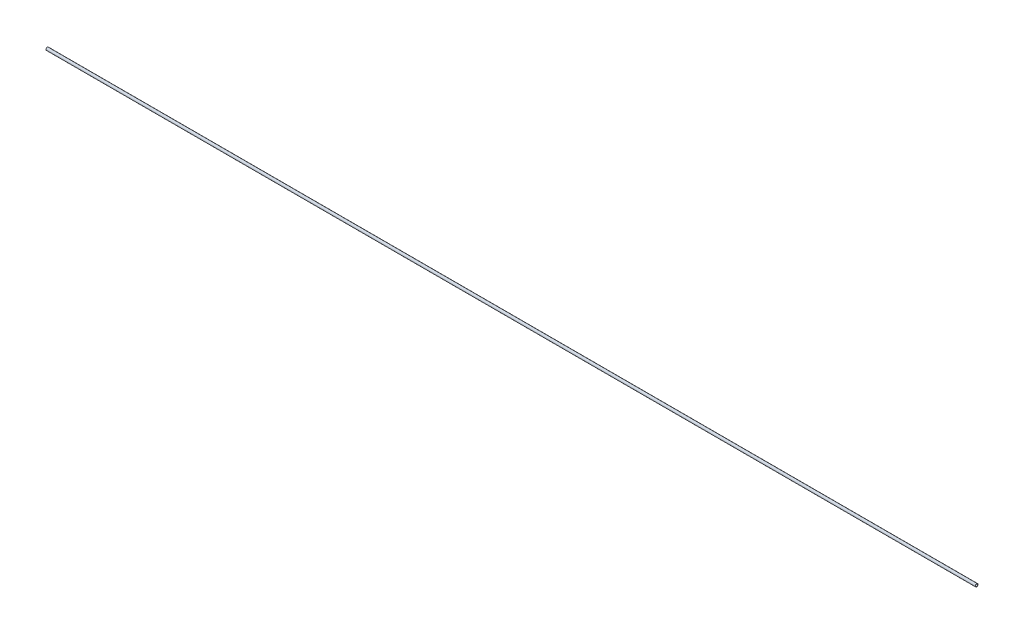
from build123d import *

# Parameters (mm, degrees)
SKETCH1_R           = 12.7
SKETCH1_R_2         = 9.652
BOSS_EXTRUDE1_DEPTH = 8580


with BuildPart() as part:
    # Sketch1 → Boss-Extrude1 (new body)
    with BuildSketch(Plane(origin=(0, 0, 0), x_dir=(0, 0, -1), z_dir=(1, 0, 0))):
        Circle(SKETCH1_R)
        Circle(SKETCH1_R_2, mode=Mode.SUBTRACT)
    extrude(amount=BOSS_EXTRUDE1_DEPTH)


solid = part.part
